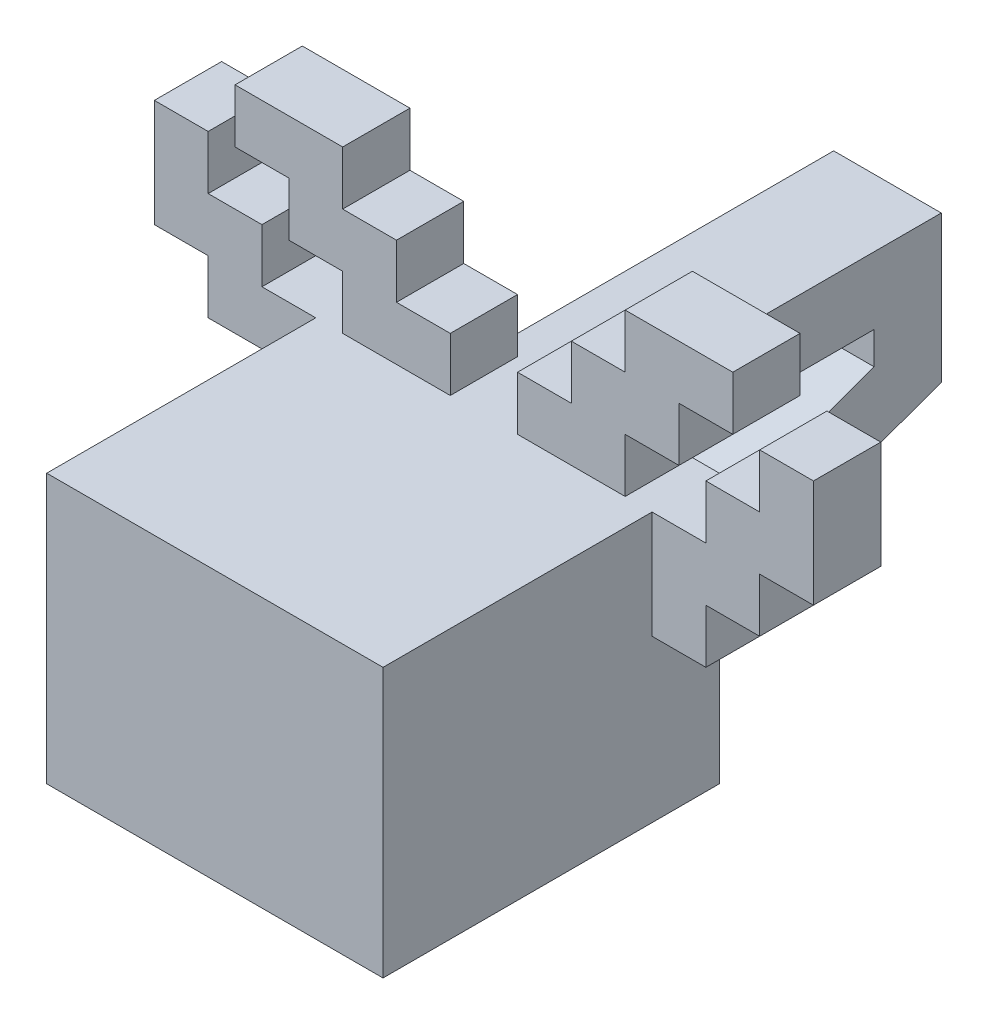
from build123d import *

# Parameters (mm, degrees)
SKETCH_1_W      = 25
SKETCH_1_H      = 20
EXTRUDE_2_DEPTH = 12.5
EXTRUDE_3_DEPTH = 4
EXTRUDE_4_DEPTH = 5


with BuildPart() as part:
    # Эскиз1 → Бобышка-Вытянуть2 (new, symmetric)
    with BuildSketch(Plane(origin=(0, 0, 0), x_dir=(0, 0, -1), z_dir=(1, 0, 0))):
        with Locations((12.5, 10)):
            Rectangle(SKETCH_1_W, SKETCH_1_H)
    extrude(amount=EXTRUDE_2_DEPTH, both=True)

    # Эскиз1<4> → Бобышка-Вытянуть3 (add, symmetric)
    with BuildSketch(Plane(origin=(0, 0, 0), x_dir=(0, 0, -1), z_dir=(1, 0, 0))):
        Polygon((25, 20), (25, 0), (50, 9.099255857), (50, 20), align=None)
        Polygon((45, 12.600293548), (30, 7.140740034), (30, 15), (45, 15), align=None, mode=Mode.SUBTRACT)
    extrude(amount=EXTRUDE_3_DEPTH, both=True)

    # Эскиз3 → Бобышка-Вытянуть4 (add)
    with BuildSketch(Plane(origin=(0, 0, -25), x_dir=(-1, 0, 0), z_dir=(0, 0, -1))):
        Polygon((-12.5, 12), (-16.5, 12), (-16.5, 16), (-20.5, 16), (-20.5, 20), (-24.5, 20), (-24.5, 28), (-20.5, 28), (-20.5, 24), (-16.5, 24), (-16.5, 20), (-12.5, 20), align=None)
        Polygon((20.5, 20), (24.5, 20), (24.5, 28), (20.5, 28), (20.5, 24), (16.5, 24), (16.5, 20), (12.5, 20), (12.5, 12), (16.5, 12), (16.5, 16), (20.5, 16), align=None)
        Polygon((-10.5, 20), (-10.5, 24), (-14.5, 24), (-14.5, 28), (-18.5, 28), (-18.5, 32), (-10.5, 32), (-10.5, 28), (-6.5, 28), (-6.5, 24), (-2.5, 24), (-2.5, 20), align=None)
        Polygon((10.5, 20), (10.5, 24), (14.5, 24), (14.5, 28), (18.5, 28), (18.5, 32), (10.5, 32), (10.5, 28), (6.5, 28), (6.5, 24), (2.5, 24), (2.5, 20), align=None)
    extrude(amount=-EXTRUDE_4_DEPTH)


solid = part.part
